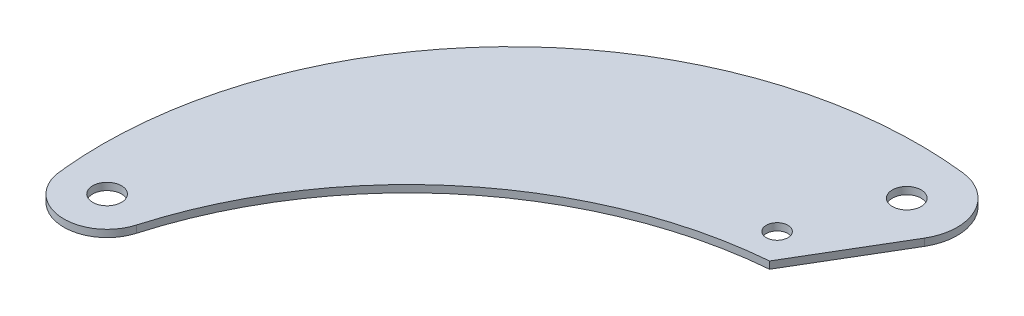
from build123d import *

# Parameters (mm, degrees)
SKETCH1_R           = 20
SKETCH1_R_2         = 15
BOSS_EXTRUDE1_DEPTH = 5


with BuildPart() as part:
    # Sketch1 → Boss-Extrude1 (new, symmetric)
    with BuildSketch(Plane(origin=(0, 0, 0), x_dir=(1, 0, 0), z_dir=(0, 1, 0))):
        with BuildLine():
            ThreePointArc((64.266544208, 563.161560744), (-397.988377373, 403.591852842), (-564.00499401, -56.38704581))
            Line((-564.00499401, -56.38704581), (-563.670163319, -56.38704581))
            ThreePointArc((-563.670163319, -56.38704581), (-563.576965484, -59.729956873), (-563.297661506, -63.062482866))
            ThreePointArc((-563.297661506, -63.062482866), (-508.728959827, -116.173403601), (-446.012064302, -72.986552362))
            ThreePointArc((-446.012064302, -72.986552362), (-266.335078189, 200.056876387), (36.550244036, 322.926786868))
            Line((36.550244036, 322.926786868), (116.550244036, 457.926786868))
            ThreePointArc((116.550244036, 457.926786868), (119.01905015, 524.75878079), (64.266544208, 563.161560744))
        make_face()
        with Locations(Location((-503.670163319, -56.38704581, 0), (0, 0, 270))):
            Circle(SKETCH1_R, mode=Mode.SUBTRACT)
        with Locations(Location((6.329836681, 363.61295419, 0), (0, 0, 270))):
            Circle(SKETCH1_R_2, mode=Mode.SUBTRACT)
        with Locations(Location((56.329836681, 493.61295419, 0), (0, 0, 270))):
            Circle(SKETCH1_R, mode=Mode.SUBTRACT)
    extrude(amount=BOSS_EXTRUDE1_DEPTH, both=True)


solid = part.part
